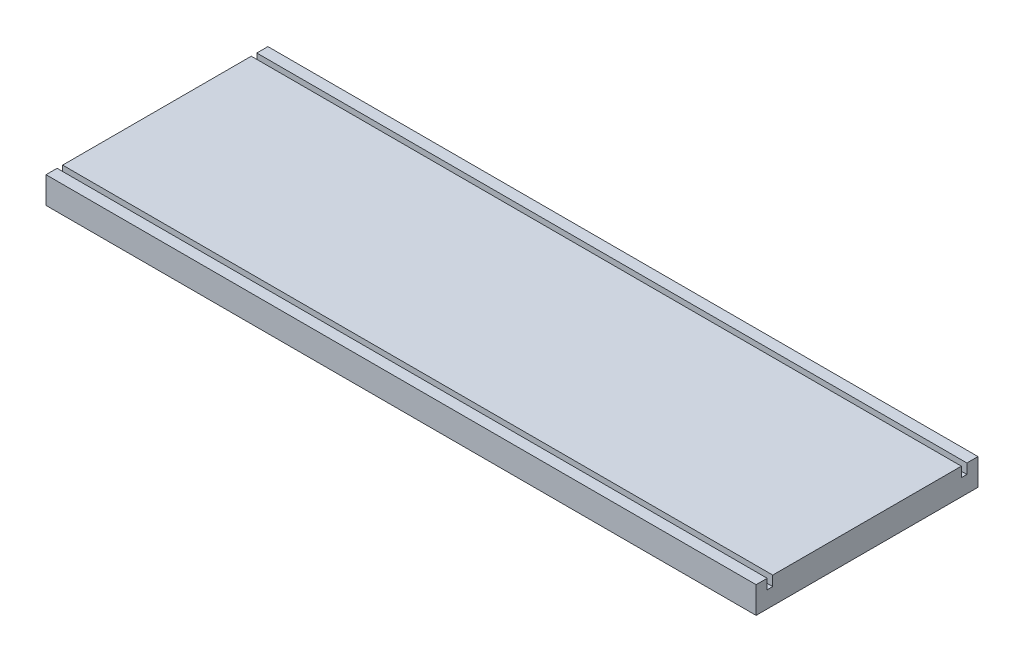
from build123d import *

# Parameters (mm, degrees)
SKETCH1_W           = 160
SKETCH1_H           = 50
BOSS_EXTRUDE1_DEPTH = 6
SKETCH3_W           = 160
SKETCH3_H           = 1.25
CUT_EXTRUDE1_DEPTH  = 2.25


with BuildPart() as part:
    # Sketch1 → Boss-Extrude1 (new body)
    with BuildSketch(Plane(origin=(0, 0, 0), x_dir=(1, 0, 0), z_dir=(0, 1, 0))):
        Rectangle(SKETCH1_W, SKETCH1_H)
    extrude(amount=BOSS_EXTRUDE1_DEPTH)

    # Sketch3 → Cut-Extrude1 (cut)
    with BuildSketch(Plane(origin=(0, 6, 0), x_dir=(1, 0, 0), z_dir=(0, 1, 0))):
        with Locations((0, -21.875)):
            Rectangle(SKETCH3_W, SKETCH3_H)
    cut_extrude1 = extrude(amount=-CUT_EXTRUDE1_DEPTH, mode=Mode.SUBTRACT)

    # Mirror1: Cut-Extrude1 across plane
    add(cut_extrude1.mirror(Plane.XY), mode=Mode.SUBTRACT)


solid = part.part
